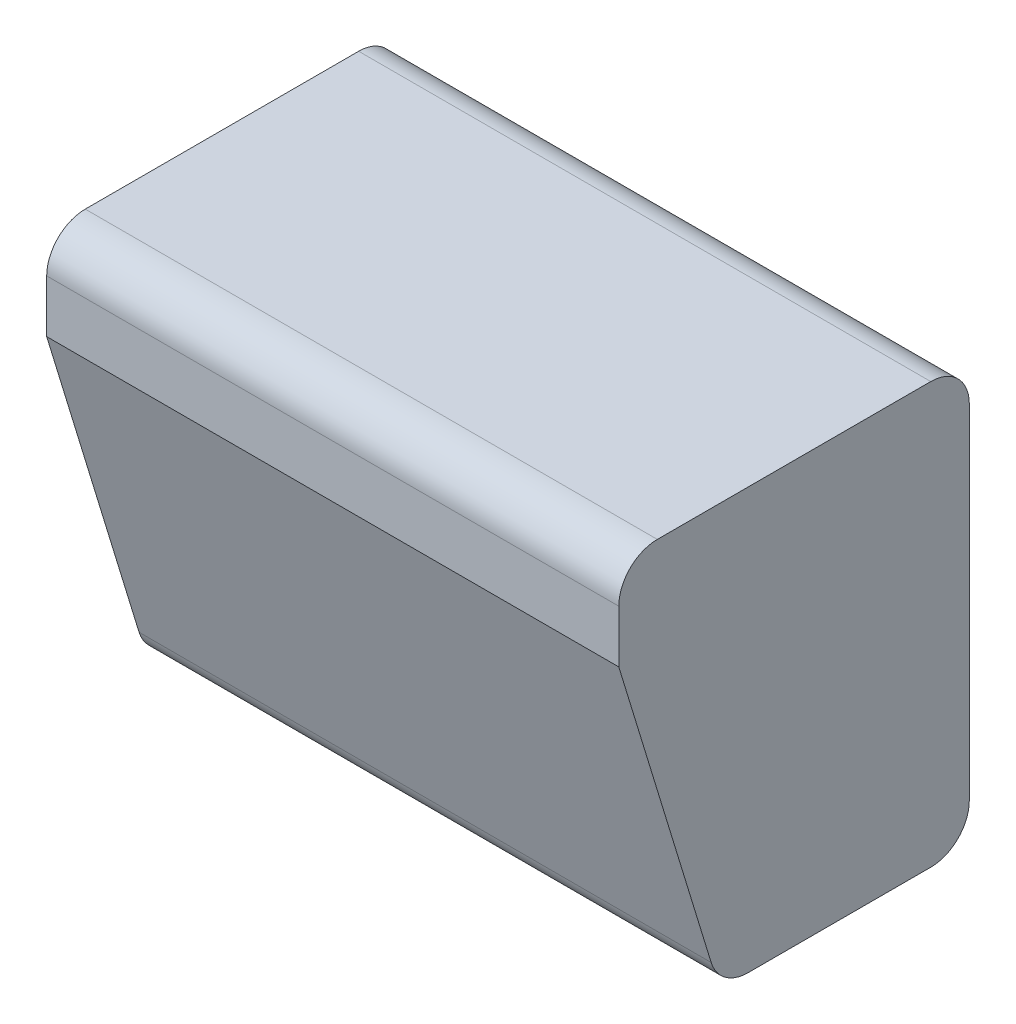
from build123d import *

# Parameters (mm, degrees)
BOSS_EXTRUDE1_DEPTH = 81.6
FILLET1_R           = 5.5


with BuildPart() as part:
    # Sketch1 → Boss-Extrude1 (new body)
    with BuildSketch(Plane(origin=(0, 0, 0), x_dir=(0, 0, -1), z_dir=(1, 0, 0))):
        Polygon((-27.320490368, 28.152364273), (22.679509632, 28.152364273), (22.679509632, -31.847635727), (-12.951148339, -31.847635727), (-27.320490368, 15.152364273), align=None)
    extrude(amount=BOSS_EXTRUDE1_DEPTH)

    # Fillet1
    fillet1_edges = [part.edges().sort_by_distance(p)[0] for p in [
        (40.8, 28.152364273, 27.320490368),
        (40.8, 28.152364273, -22.679509632),
        (40.8, -31.847635727, -22.679509632),
        (40.8, -31.847635727, 12.951148339),
    ]]
    fillet(fillet1_edges, radius=FILLET1_R)


solid = part.part
